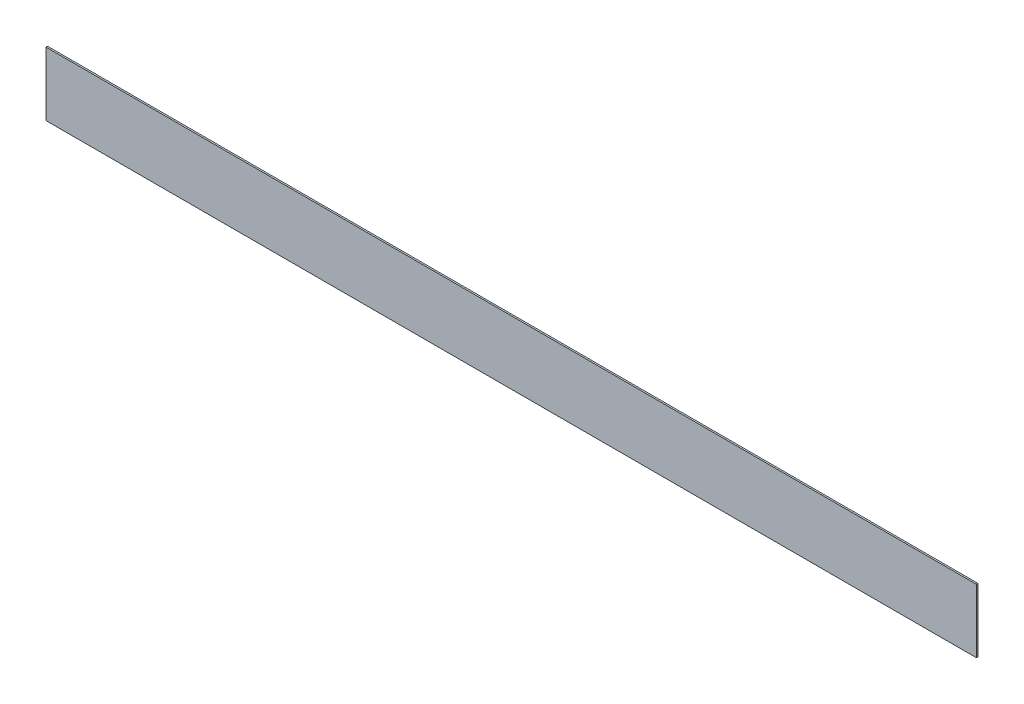
from build123d import *

# Parameters (mm, degrees)
SKETCH1_W           = 1170
SKETCH1_H           = 80
BOSS_EXTRUDE1_DEPTH = 2


with BuildPart() as part:
    # Sketch1 → Boss-Extrude1 (new body)
    with BuildSketch(Plane.XY):
        with Locations((585, -40)):
            Rectangle(SKETCH1_W, SKETCH1_H)
    extrude(amount=BOSS_EXTRUDE1_DEPTH)


solid = part.part
